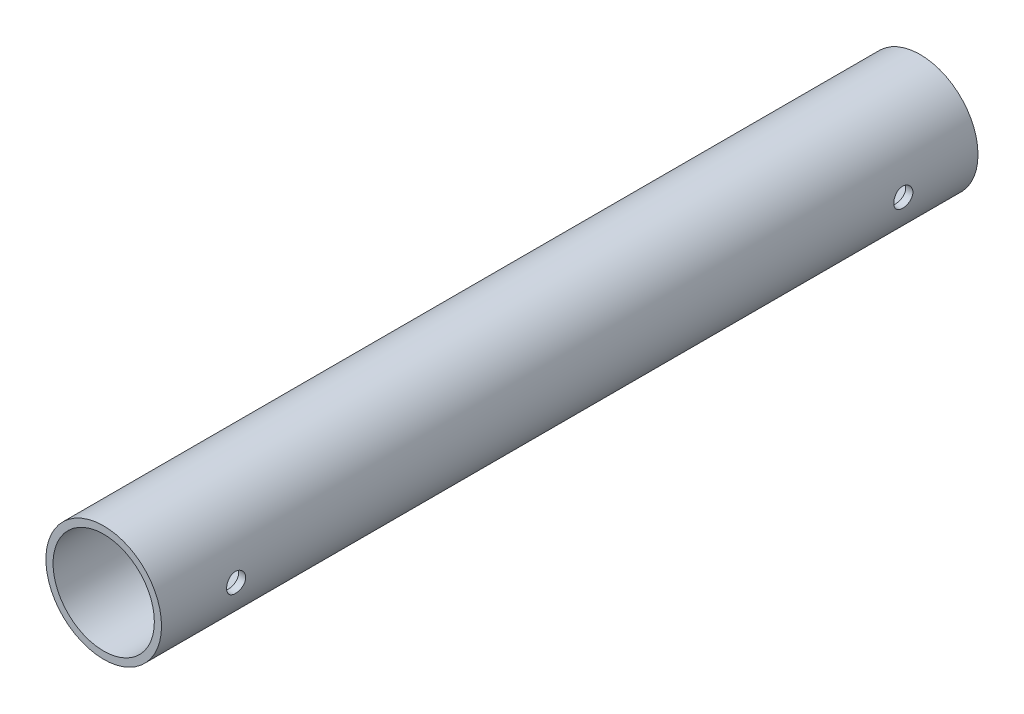
from build123d import *

# Parameters (mm, degrees)
SKETCH1_R           = 12.1
SKETCH1_R_2         = 10.6
BOSS_EXTRUDE1_DEPTH = 85.445
SKETCH2_R           = 2
CUT_EXTRUDE1_DEPTH  = 88.141654936


with BuildPart() as part:
    # Sketch1 → Boss-Extrude1 (new body)
    with BuildSketch(Plane.XY):
        Circle(SKETCH1_R)
        Circle(SKETCH1_R_2, mode=Mode.SUBTRACT)
    boss_extrude1 = extrude(amount=BOSS_EXTRUDE1_DEPTH)

    # Sketch2 → Cut-Extrude1 (cut, symmetric)
    with BuildSketch(Plane(origin=(0, 0, 0), x_dir=(0, 0, -1), z_dir=(1, 0, 0))):
        with Locations((-69.82, 0)):
            Circle(SKETCH2_R)
    cut_extrude1 = extrude(amount=CUT_EXTRUDE1_DEPTH, both=True, mode=Mode.SUBTRACT)

    # Mirror1: Boss-Extrude1, Cut-Extrude1 across plane
    add(boss_extrude1.mirror(Plane.XY))
    add(cut_extrude1.mirror(Plane.XY), mode=Mode.SUBTRACT)


solid = part.part
